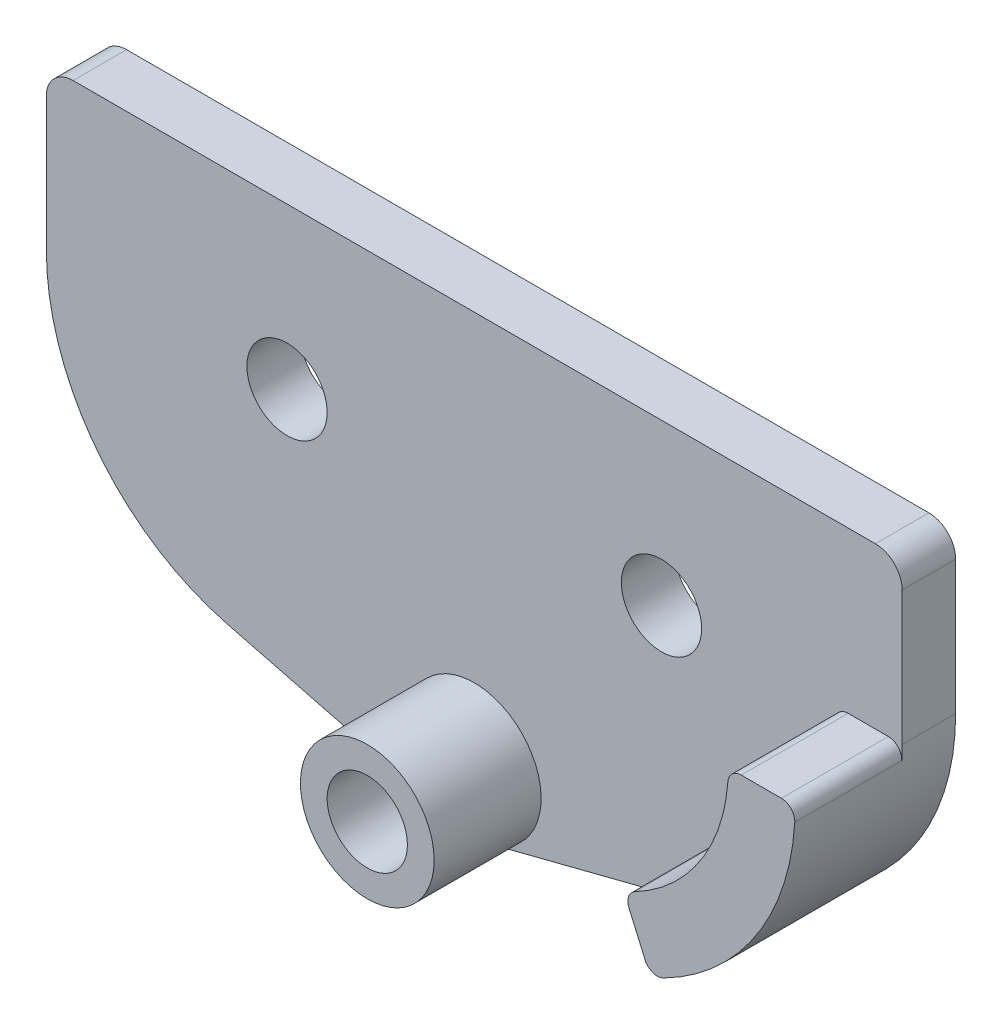
from build123d import *

# Parameters (mm, degrees)
SKETCH_2_R      = 1.5
EXTRUDE_1_DEPTH = 2
EXTRUDE_2_DEPTH = 4
FILLET_1_R      = 1
FILLET_4_R      = 0.5
SKETCH_4_R      = 2.5
SKETCH_4_R_2    = 1.5
EXTRUDE_3_DEPTH = 4


with BuildPart() as part:
    # 草图2 → 凸台-拉伸1 (new body)
    with BuildSketch(Plane.XY):
        with BuildLine():
            Line((7, 6), (-7, 6))
            Line((-7, 6), (-16, 6))
            Line((-16, 6), (-16, 0))
            ThreePointArc((-16, 0), (-14.108952351, -5.519311231), (-9.230489674, -8.71922679))
            Line((-9.230489674, -8.71922679), (-0.619580465, -10.922007442))
            ThreePointArc((-0.619580465, -10.922007442), (0, -11), (0.619580465, -10.922007442))
            Line((0.619580465, -10.922007442), (9.230489674, -8.71922679))
            ThreePointArc((9.230489674, -8.71922679), (14.108952351, -5.519311231), (16, 0))
            Line((16, 0), (16, 6))
            Line((16, 6), (7, 6))
        make_face()
        with Locations((0, -8.5)):
            Circle(SKETCH_2_R, mode=Mode.SUBTRACT)
        with Locations((7, 0)):
            Circle(SKETCH_2_R, mode=Mode.SUBTRACT)
        with Locations(Location((-7, 0, 0), (0, 0, 180))):
            Circle(SKETCH_2_R, mode=Mode.SUBTRACT)
    extrude(amount=EXTRUDE_1_DEPTH)

    # 草图3 → 凸台-拉伸2 (add)
    with BuildSketch(Plane.XY.offset(2)):
        with BuildLine():
            Line((13.5, 0), (16, 0))
            ThreePointArc((16, 0), (14.527522767, -4.933193793), (10.591910889, -8.252161909))
            Line((10.591910889, -8.252161909), (9.594157864, -5.959894712))
            ThreePointArc((9.594157864, -5.959894712), (12.43654422, -3.562862184), (13.5, 0))
        make_face()
    extrude(amount=EXTRUDE_2_DEPTH)

    # 圆角1
    fillet_1_edges = [part.edges().sort_by_distance(p)[0] for p in [
        (-16, 6, 1),
        (16, 6, 1),
    ]]
    fillet(fillet_1_edges, radius=FILLET_1_R)

    # 圆角4
    fillet_4_edges = [part.edges().sort_by_distance(p)[0] for p in [
        (10.591910889, -8.252161909, 4),
        (16, 0, 4),
        (13.5, 0, 4),
        (9.594157864, -5.959894712, 4),
    ]]
    fillet(fillet_4_edges, radius=FILLET_4_R)

    # 草图4 → 凸台-拉伸3 (add)
    with BuildSketch(Plane.XY.offset(2)):
        with Locations(Location((0, -8.5, 0), (0, 0, 255.650730884))):
            Circle(SKETCH_4_R)
        with Locations((0, -8.5)):
            Circle(SKETCH_4_R_2, mode=Mode.SUBTRACT)
    extrude(amount=EXTRUDE_3_DEPTH)


solid = part.part
